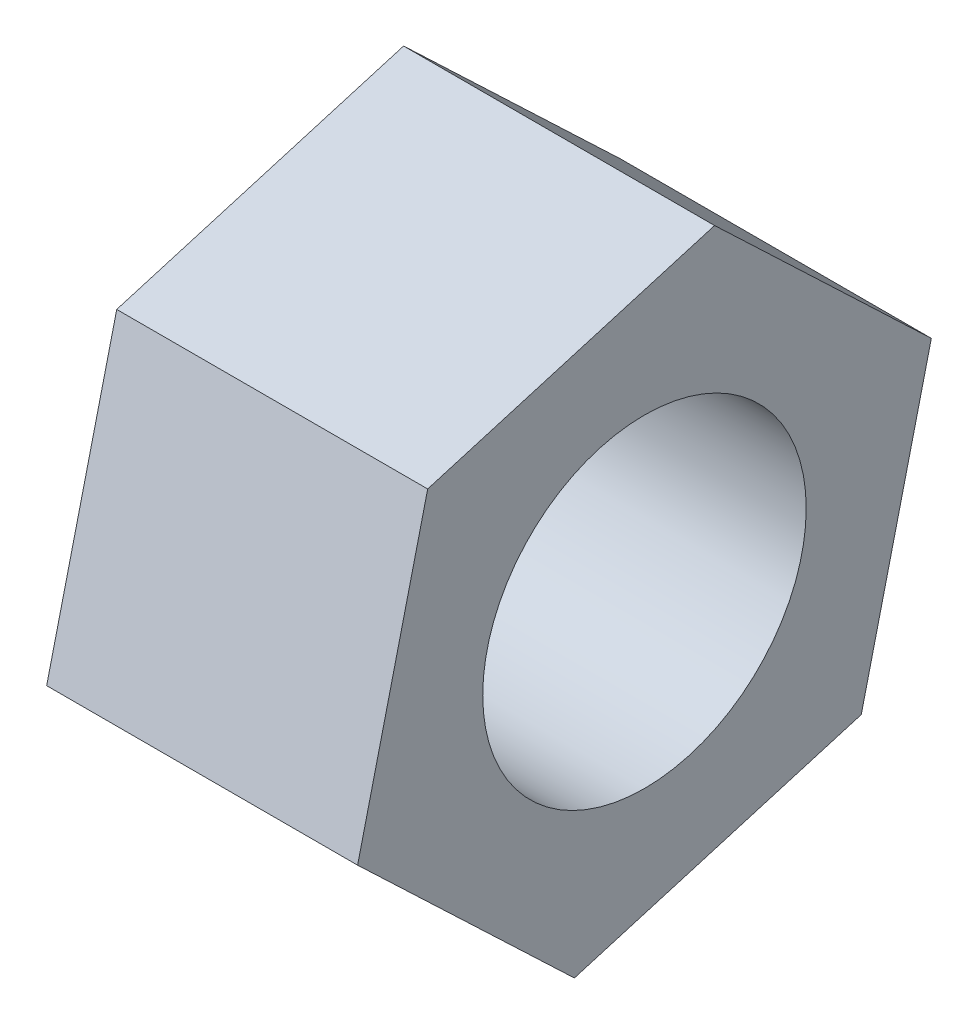
from build123d import *

# Parameters (mm, degrees)
BOSS_EXTRUDE1_DEPTH = 5.96
SKETCH2_R           = 3.1
CUT_EXTRUDE1_DEPTH  = 10.839626207


with BuildPart() as part:
    # Sketch1 → Boss-Extrude1 (new body)
    with BuildSketch(Plane(origin=(0, 0, 0), x_dir=(0, 0, -1), z_dir=(1, 0, 0))):
        Polygon((4.155170095, -3.950045757), (5.498425019, 1.623459981), (1.343254924, 5.573505738), (-4.155170095, 3.950045757), (-5.498425019, -1.623459981), (-1.343254924, -5.573505738), align=None)
    extrude(amount=BOSS_EXTRUDE1_DEPTH)

    # Sketch2 → Cut-Extrude1 (cut, through all)
    with BuildSketch(Plane(origin=(5.96, 0, 0), x_dir=(0, 0, -1), z_dir=(1, 0, 0))):
        Circle(SKETCH2_R)
    extrude(amount=-CUT_EXTRUDE1_DEPTH, mode=Mode.SUBTRACT)


solid = part.part
